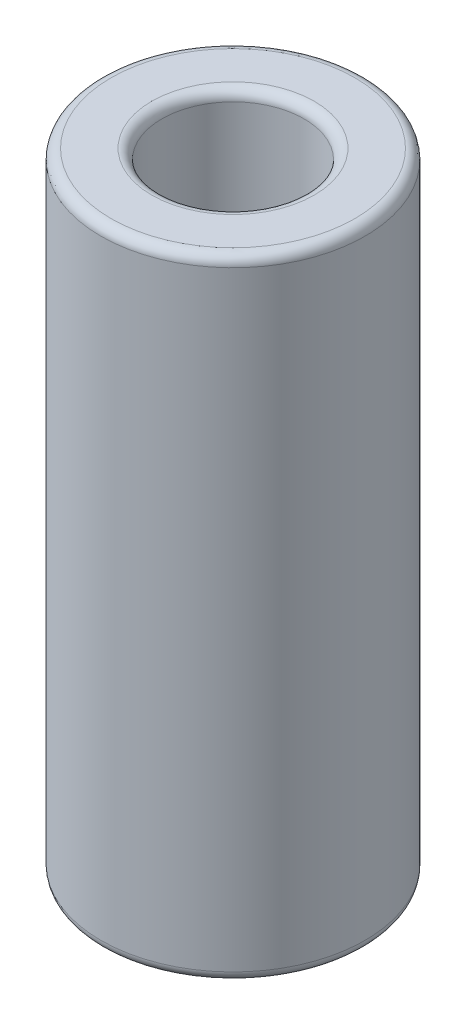
from build123d import *

# Parameters (mm, degrees)
SKETCH1_R           = 13
SKETCH1_R_2         = 7
BOSS_EXTRUDE1_DEPTH = 62
FILLET2_R           = 1
FILLET3_R           = 1


with BuildPart() as part:
    # Sketch1 → Boss-Extrude1 (new body)
    with BuildSketch(Plane(origin=(0, 0, 0), x_dir=(1, 0, 0), z_dir=(0, 1, 0))):
        with Locations(Location((0, 0, 0), (0, 0, 270))):
            Circle(SKETCH1_R)
        with Locations(Location((0, 0, 0), (0, 0, 270))):
            Circle(SKETCH1_R_2, mode=Mode.SUBTRACT)
    extrude(amount=BOSS_EXTRUDE1_DEPTH)

    # Fillet2
    fillet2_edges = [part.edges().sort_by_distance(p)[0] for p in [
        (0, 0, -13),
        (0, 62, -13),
    ]]
    fillet(fillet2_edges, radius=FILLET2_R)

    # Fillet3
    fillet3_edges = [part.edges().sort_by_distance(p)[0] for p in [
        (0, 0, -7),
        (0, 62, -7),
    ]]
    fillet(fillet3_edges, radius=FILLET3_R)


solid = part.part
